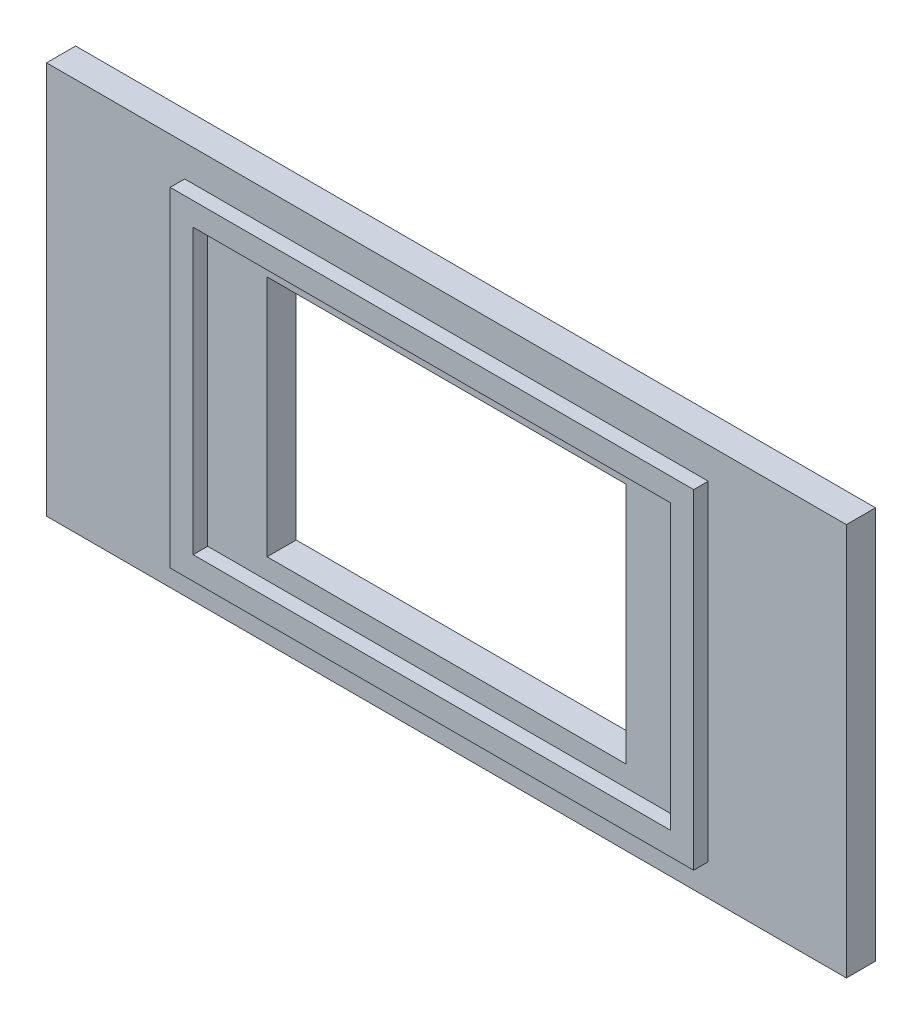
from build123d import *

# Parameters (mm, degrees)
SKETCH1_W           = 165
SKETCH1_H           = 81
SKETCH1_W_2         = 74
SKETCH1_H_2         = 50
BOSS_EXTRUDE1_DEPTH = 6
SKETCH2_W           = 108
SKETCH2_H           = 68
SKETCH2_W_2         = 98.5
SKETCH2_H_2         = 58.5
BOSS_EXTRUDE2_DEPTH = 9


with BuildPart() as part:
    # Sketch1 → Boss-Extrude1 (new body)
    with BuildSketch(Plane.XY):
        Rectangle(SKETCH1_W, SKETCH1_H)
        Rectangle(SKETCH1_W_2, SKETCH1_H_2, mode=Mode.SUBTRACT)
    extrude(amount=BOSS_EXTRUDE1_DEPTH)

    # Sketch2 → Boss-Extrude2 (add)
    with BuildSketch(Plane.XY):
        Rectangle(SKETCH2_W, SKETCH2_H)
        Rectangle(SKETCH2_W_2, SKETCH2_H_2, mode=Mode.SUBTRACT)
    extrude(amount=BOSS_EXTRUDE2_DEPTH)


solid = part.part
